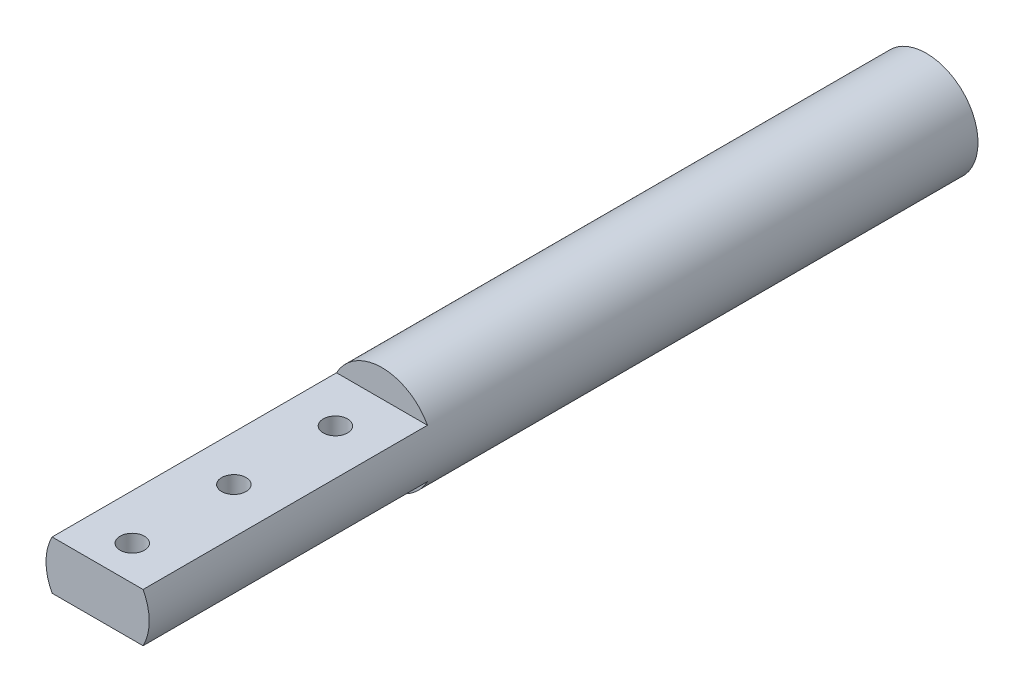
from build123d import *

# Parameters (mm, degrees)
SKETCH1_R           = 6.35
BOSS_EXTRUDE1_DEPTH = 51
CUT_EXTRUDE1_DEPTH  = 35
SKETCH3_R           = 1.5
CUT_EXTRUDE2_DEPTH  = 15


with BuildPart() as part:
    # Sketch1 → Boss-Extrude1 (new, symmetric)
    with BuildSketch(Plane.XY):
        Circle(SKETCH1_R)
    extrude(amount=BOSS_EXTRUDE1_DEPTH, both=True)

    # Sketch2 → Cut-Extrude1 (cut)
    with BuildSketch(Plane.XY.offset(51)):
        with BuildLine():
            ThreePointArc((5.596650784, 3), (0, 6.35), (-5.596650784, 3))
            Line((-5.596650784, 3), (5.596650784, 3))
        make_face()
        with BuildLine():
            Line((5.596650784, -3), (-5.596650784, -3))
            ThreePointArc((-5.596650784, -3), (0, -6.35), (5.596650784, -3))
        make_face()
    extrude(amount=-CUT_EXTRUDE1_DEPTH, mode=Mode.SUBTRACT)

    # Sketch3 → Cut-Extrude2 (cut)
    with BuildSketch(Plane(origin=(0, 3, 0), x_dir=(1, 0, 0), z_dir=(0, 1, 0))):
        with Locations(Location((0, -21.732039108, 0), (0, 0, 90))):
            Circle(SKETCH3_R)
        with Locations(Location((0, -34.232039108, 0), (0, 0, 90))):
            Circle(SKETCH3_R)
        with Locations(Location((0, -46.732039108, 0), (0, 0, 90))):
            Circle(SKETCH3_R)
    extrude(amount=-CUT_EXTRUDE2_DEPTH, mode=Mode.SUBTRACT)


solid = part.part
